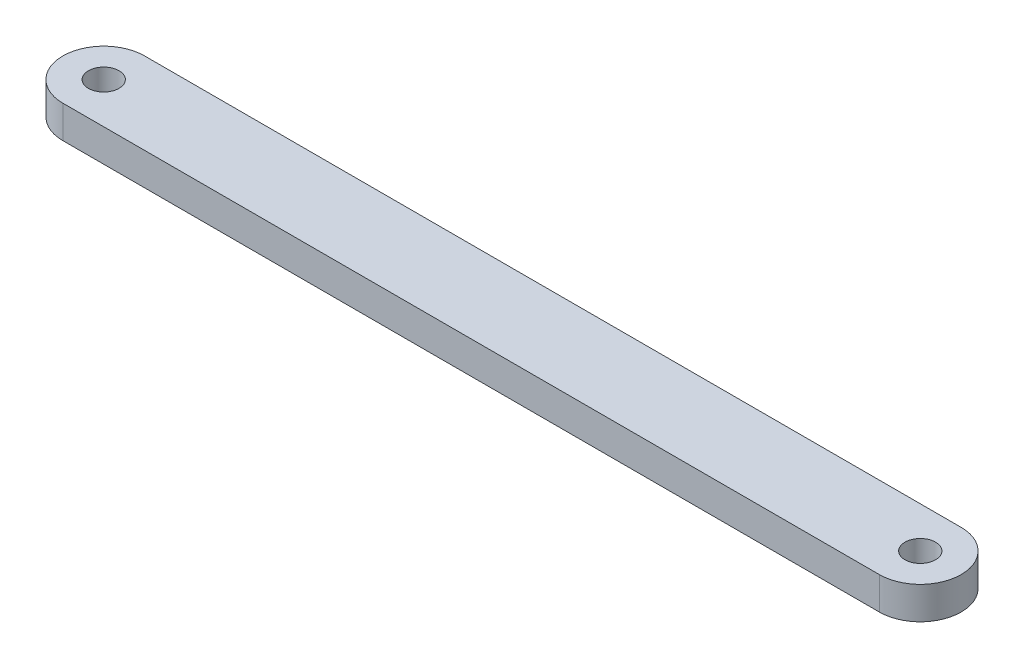
from build123d import *

# Parameters (mm, degrees)
SKETCH1_R           = 1.497293459
BOSS_EXTRUDE1_DEPTH = 3.175


with BuildPart() as part:
    # Sketch1 → Boss-Extrude1 (new body)
    with BuildSketch(Plane(origin=(0, 0, 0), x_dir=(1, 0, 0), z_dir=(0, 1, 0))):
        with BuildLine():
            Line((40.018335965, 4.000091093), (-39.839960243, 4.000091093))
            ThreePointArc((-39.839960243, 4.000091093), (-43.840051334, 2e-09), (-39.839960243, -4.000091089))
            Line((-39.839960243, -4.000091089), (40.018335965, -4.000091089))
            ThreePointArc((40.018335965, -4.000091089), (44.018427056, 2e-09), (40.018335965, 4.000091093))
        make_face()
        with Locations(Location((-39.839960243, 2e-09, 0), (0, 0, 270))):
            Circle(SKETCH1_R, mode=Mode.SUBTRACT)
        with Locations(Location((40.018335965, 2e-09, 0), (0, 0, 270))):
            Circle(SKETCH1_R, mode=Mode.SUBTRACT)
    extrude(amount=BOSS_EXTRUDE1_DEPTH)


solid = part.part
